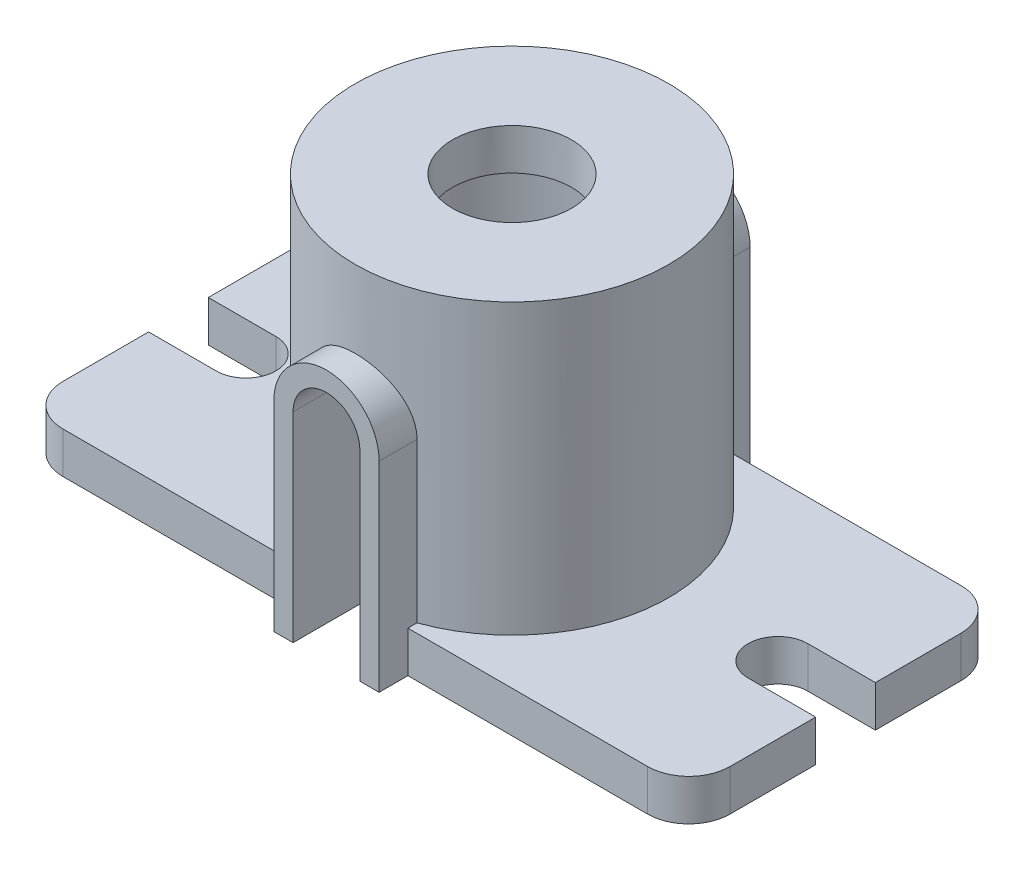
from build123d import *

# Parameters (mm, degrees)
SKETCH_1_W           = 161.815887324
SKETCH_1_H           = 76.02828169
EXTRUDE_1_DEPTH      = 10
FILLET_1_R           = 10
CUT_EXTRUDE_5_DEPTH  = 27
SKETCH_5_R           = 38.014140845
EXTRUDE_2_DEPTH      = 80
EXTRUDE_4_DEPTH      = 45
EXTRUDE_4_DEPTH_BACK = 45
CUT_EXTRUDE_6_DEPTH  = 119
SKETCH_11_R          = 28.263571039
CUT_EXTRUDE_8_DEPTH  = 70
SKETCH_12_R          = 14.431437431
CUT_EXTRUDE_9_DEPTH  = 70


with BuildPart() as part:
    # 草图1 → 凸台-拉伸1 (new body)
    with BuildSketch(Plane(origin=(0, 0, 0), x_dir=(1, 0, 0), z_dir=(0, 1, 0))):
        Rectangle(SKETCH_1_W, SKETCH_1_H)
    extrude(amount=EXTRUDE_1_DEPTH)

    # 圆角1
    fillet_1_edges = [part.edges().sort_by_distance(p)[0] for p in [
        (80.907943662, 5, 38.014140845),
        (-80.907943662, 5, 38.014140845),
        (-80.907943662, 5, -38.014140845),
        (80.907943662, 5, -38.014140845),
    ]]
    fillet(fillet_1_edges, radius=FILLET_1_R)

    # 草图4 → 切除-拉伸5 (cut)
    with BuildSketch(Plane(origin=(0, 0, 0), x_dir=(1, 0, 0), z_dir=(0, 1, 0))):
        with BuildLine():
            Line((-80.907943662, 7.242463814), (-64.523768529, 7.242463814))
            ThreePointArc((-64.523768529, 7.242463814), (-57.281304715, 0), (-64.523768529, -7.242463814))
            Line((-64.523768529, -7.242463814), (-80.907943662, -7.242463814))
            Line((-80.907943662, -7.242463814), (-80.907943662, 7.242463814))
        make_face()
    cut_extrude_5 = extrude(amount=CUT_EXTRUDE_5_DEPTH, mode=Mode.SUBTRACT)

    # 镜向7: 切除-拉伸5 across plane
    add(cut_extrude_5.mirror(Plane(origin=(0, 0, 0), x_dir=(0, 0, 1), z_dir=(1, 0, 0))), mode=Mode.SUBTRACT)

    # 草图5 → 凸台-拉伸2 (add)
    with BuildSketch(Plane(origin=(0, 0, 0), x_dir=(1, 0, 0), z_dir=(0, 1, 0))):
        with Locations(Location((0, 0, 0), (0, 0, 270))):
            Circle(SKETCH_5_R)
    extrude(amount=EXTRUDE_2_DEPTH)

    # 草图6 → 凸台-拉伸4 (add, two sides: drawn at the far end of the back side and taken through both)
    with BuildSketch(Plane.XY.offset(-EXTRUDE_4_DEPTH_BACK)):
        with BuildLine():
            Line((-12.762943226, 0), (-12.762943226, 48.559275417))
            ThreePointArc((-12.762943226, 48.559275417), (0, 61.322218643), (12.762943226, 48.559275417))
            Line((12.762943226, 48.559275417), (12.762943226, 0))
            Line((12.762943226, 0), (-12.762943226, 0))
        make_face()
    extrude(amount=EXTRUDE_4_DEPTH + EXTRUDE_4_DEPTH_BACK)

    # 草图9 → 切除-拉伸6 (cut)
    with BuildSketch(Plane.XY.offset(45)):
        with BuildLine():
            Line((-8.103456016, 0), (-8.103456016, 48.501805974))
            ThreePointArc((-8.103456016, 48.501805974), (0, 56.60526199), (8.103456016, 48.501805974))
            Line((8.103456016, 48.501805974), (8.103456016, 0))
            Line((8.103456016, 0), (-8.103456016, 0))
        make_face()
    extrude(amount=-CUT_EXTRUDE_6_DEPTH, mode=Mode.SUBTRACT)

    # 草图11 → 切除-拉伸8 (cut)
    with BuildSketch(Plane.XZ):
        with Locations(Location((0, 0, 0), (0, 0, 270))):
            Circle(SKETCH_11_R)
    extrude(amount=-CUT_EXTRUDE_8_DEPTH, mode=Mode.SUBTRACT)

    # 草图12 → 切除-拉伸9 (cut)
    with BuildSketch(Plane(origin=(0, 80, 0), x_dir=(1, 0, 0), z_dir=(0, 1, 0))):
        with Locations(Location((0, 0, 0), (0, 0, 270))):
            Circle(SKETCH_12_R)
    extrude(amount=-CUT_EXTRUDE_9_DEPTH, mode=Mode.SUBTRACT)


solid = part.part
